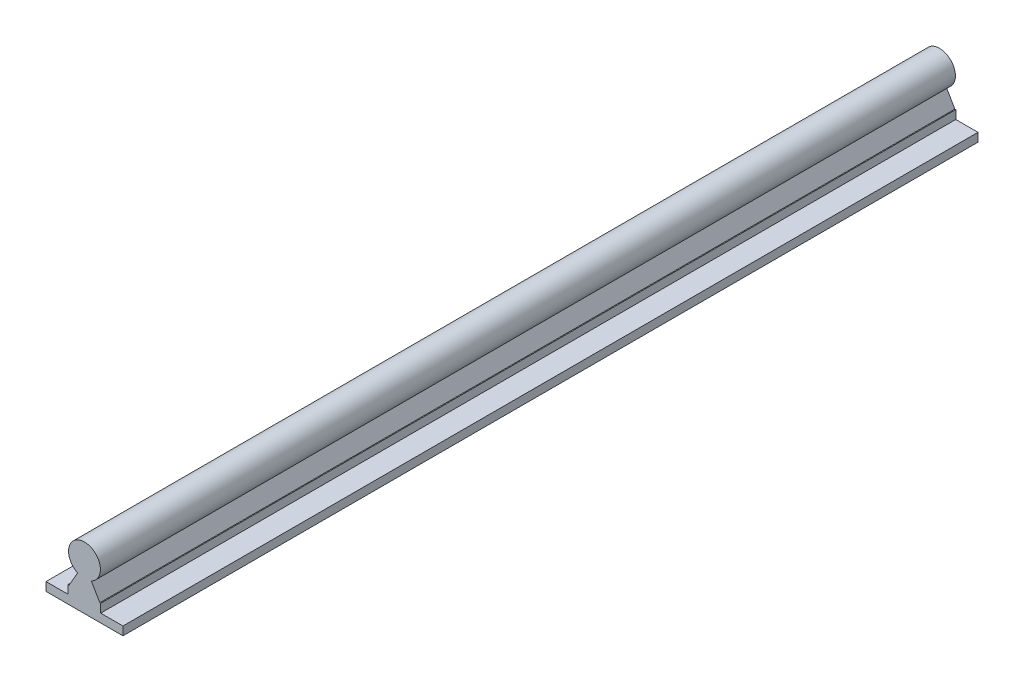
from build123d import *

# Parameters (mm, degrees)
EXTRUSION1_DEPTH = 500


with BuildPart() as part:
    # Sketch1 → Extrusion1 (new body)
    with BuildSketch(Plane.XY):
        with BuildLine():
            Line((-22.5, 0), (22.5, 0))
            Line((22.5, 0), (22.5, 5))
            Line((22.5, 5), (9.5, 5))
            Line((9.5, 5), (9.5, 10))
            Line((9.5, 10), (8.967618538, 10))
            Line((8.967618538, 10), (4, 18.604167701))
            ThreePointArc((4, 18.604167701), (0, 36.3), (-4, 18.604167701))
            Line((-4, 18.604167701), (-8.967618538, 10))
            Line((-8.967618538, 10), (-9.5, 10))
            Line((-9.5, 10), (-9.5, 5))
            Line((-9.5, 5), (-22.5, 5))
            Line((-22.5, 5), (-22.5, 0))
        make_face()
    extrude(amount=EXTRUSION1_DEPTH)


solid = part.part
